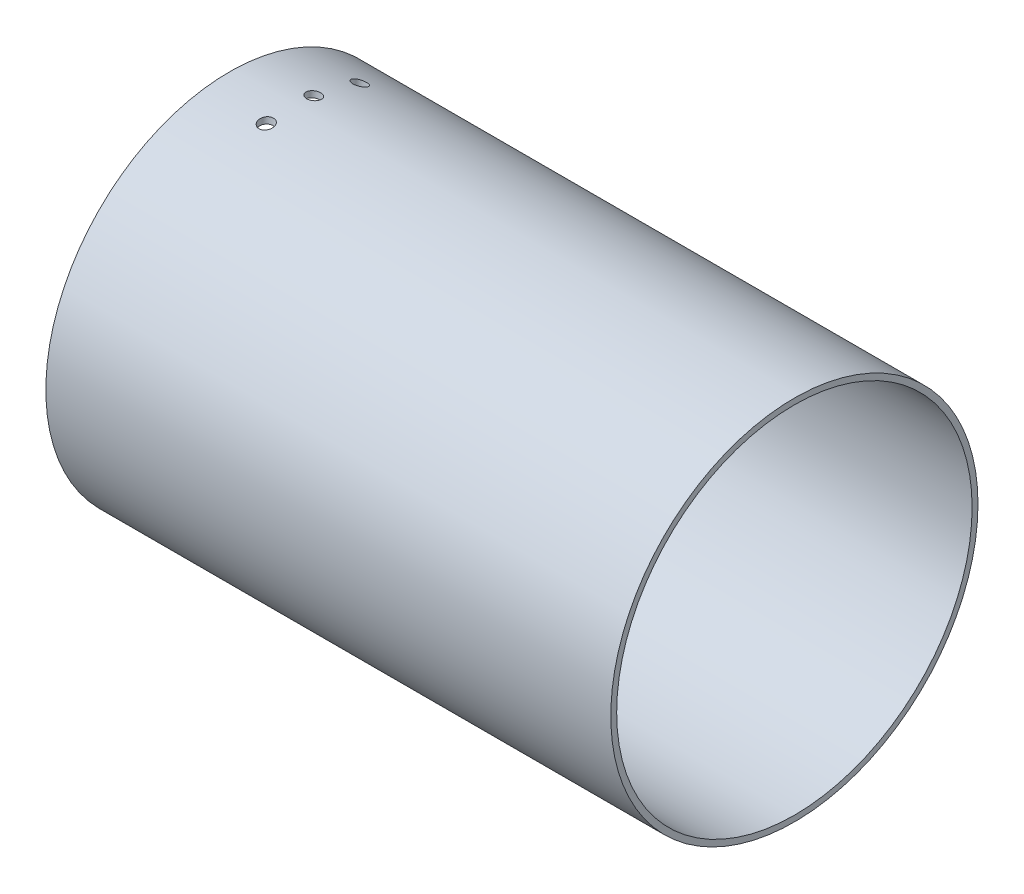
from build123d import *

# Parameters (mm, degrees)
SKETCH1_R               = 49.53
SKETCH1_R_2             = 47.9425
BOSS_EXTRUDE1_DEPTH     = 152.4
CUT_EXTRUDE1_DEPTH      = 642.495475246
CUT_EXTRUDE1_DEPTH_BACK = 642.495475246
SKETCH2_R               = 1.905


with BuildPart() as part:
    # Sketch1 → Boss-Extrude1 (new body)
    with BuildSketch(Plane(origin=(0, 0, 0), x_dir=(0, 0, -1), z_dir=(1, 0, 0))):
        with Locations(Location((0, 0, 0), (0, 0, 180))):
            Circle(SKETCH1_R)
        with Locations(Location((0, 0, 0), (0, 0, 180))):
            Circle(SKETCH1_R_2, mode=Mode.SUBTRACT)
    extrude(amount=BOSS_EXTRUDE1_DEPTH)

    # Sketch2 → Cut-Extrude1 (cut, two sides: drawn at the far end of the back side and taken through both)
    with BuildSketch(Plane(origin=(-485.259786219, 0, 0), x_dir=(0, 0.12524438136346008, 0.9921259219156024), z_dir=(0, 0.9921259219156026, -0.12524438136346008)).offset(-CUT_EXTRUDE1_DEPTH_BACK)):
        with Locations((12.7, 501.801536219)):
            Circle(SKETCH2_R)
        with Locations((0, 501.801536219)):
            Circle(SKETCH2_R)
        with Locations((-12.7, 501.801536219)):
            Circle(SKETCH2_R)
    extrude(amount=CUT_EXTRUDE1_DEPTH + CUT_EXTRUDE1_DEPTH_BACK, mode=Mode.SUBTRACT)


solid = part.part
